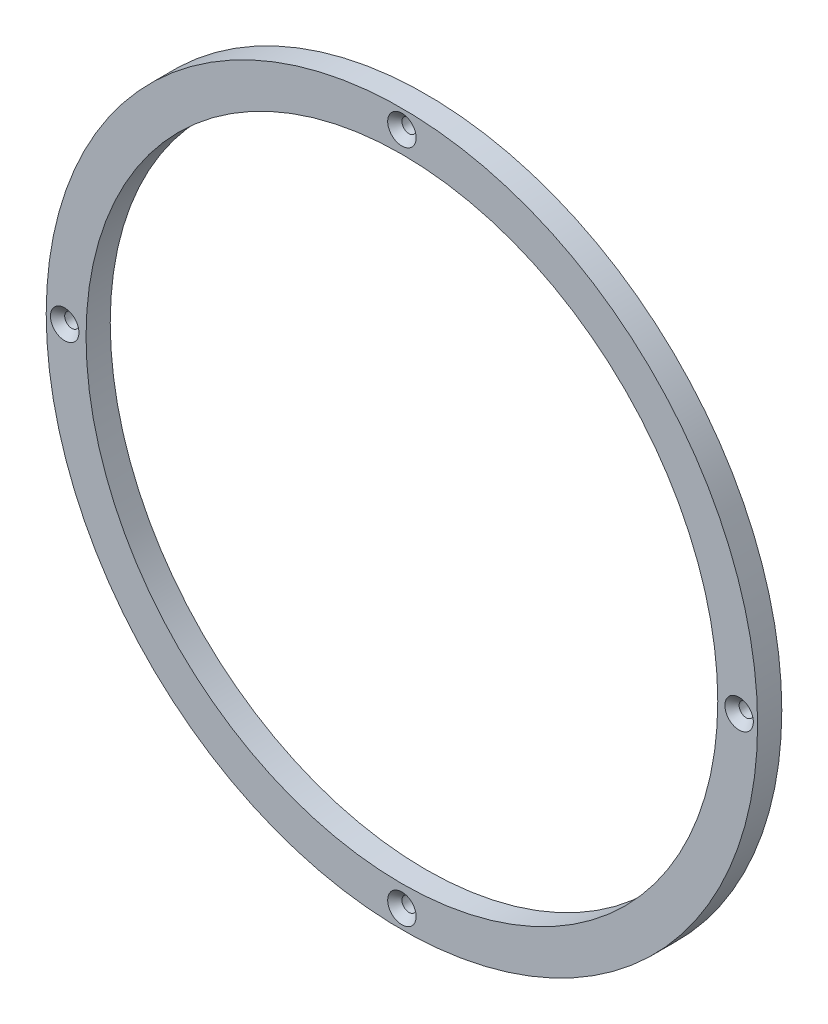
from build123d import *

# Parameters (mm, degrees)
SCHIZZO1_R                                           = 125
SCHIZZO1_R_2                                         = 111
ESTRUSIONE_ESTRUSIONE1_DEPTH                         = 8.5
FORO_SVASATO_PER_VITE_M4_A_TESTA_SVASATA_D           = 5
FORO_SVASATO_PER_VITE_M4_A_TESTA_SVASATA_CSINK_D     = 10
FORO_SVASATO_PER_VITE_M4_A_TESTA_SVASATA_CSINK_ANGLE = 90
RIPETIZIONECIRCOLARE1_COUNT                          = 4


with BuildPart() as part:
    # Schizzo1 → Estrusione-Estrusione1 (new body)
    with BuildSketch(Plane.XY):
        Circle(SCHIZZO1_R)
        Circle(SCHIZZO1_R_2, mode=Mode.SUBTRACT)
    extrude(amount=ESTRUSIONE_ESTRUSIONE1_DEPTH)

    # Foro svasato per Vite M4 a testa svasata cilindrica2 (through all)
    with Locations(Plane.XY.offset(8.5)):
        with Locations((0, -118.5)):
            foro_svasato_per_vite_m4_a_testa_svasata = CounterSinkHole(FORO_SVASATO_PER_VITE_M4_A_TESTA_SVASATA_D / 2, FORO_SVASATO_PER_VITE_M4_A_TESTA_SVASATA_CSINK_D / 2, counter_sink_angle=FORO_SVASATO_PER_VITE_M4_A_TESTA_SVASATA_CSINK_ANGLE)

    # RipetizioneCircolare1: Foro svasato per Vite M4 a testa svasata cilindrica2 ×4 about axis
    ripetizionecircolare1_axis = Axis((0, 0, 0), (0, 0, 1))
    for i in range(1, RIPETIZIONECIRCOLARE1_COUNT):
        add(foro_svasato_per_vite_m4_a_testa_svasata.rotate(ripetizionecircolare1_axis, i * 360 / RIPETIZIONECIRCOLARE1_COUNT), mode=Mode.SUBTRACT)


solid = part.part
